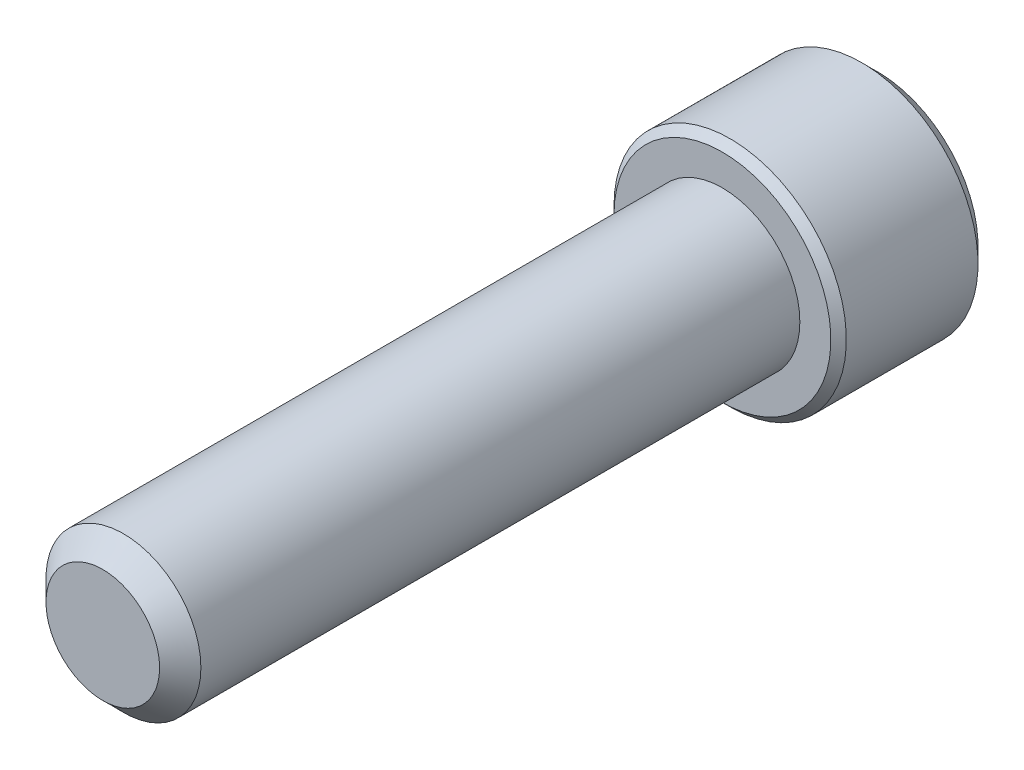
from build123d import *

# Parameters (mm, degrees)
SKETCH1_R          = 3.96875
EXTRUDE1_DEPTH     = 31.75
SKETCH6_R          = 5.953125
EXTRUDE2_DEPTH     = 7.9375
CUT_EXTRUDE1_DEPTH = 4.7625
SKETCH8_R          = 3.666174209
CUT_EXTRUDE2_DEPTH = 0.79375
CUT_EXTRUDE2_DRAFT = -45
CHAMFER1_SIZE      = 0.79375
CHAMFER2_SIZE      = 0.396875
CHAMFER3_SIZE      = 1.058333333


with BuildPart() as part:
    # Sketch1 → Extrude1 (new body)
    with BuildSketch(Plane.XY):
        Circle(SKETCH1_R)
    extrude(amount=-EXTRUDE1_DEPTH)

    # Sketch6 → Extrude2 (add)
    with BuildSketch(Plane(origin=(0, 0, -31.75), x_dir=(-1, 0, 0), z_dir=(0, 0, -1))):
        Circle(SKETCH6_R)
    extrude(amount=EXTRUDE2_DEPTH)

    # Sketch7 → Cut-Extrude1 (cut)
    with BuildSketch(Plane(origin=(0, 0, -39.6875), x_dir=(-1, 0, 0), z_dir=(0, 0, -1))):
        Polygon((0, 3.666174209), (-3.175, 1.833087105), (-3.175, -1.833087105), (0, -3.666174209), (3.175, -1.833087105), (3.175, 1.833087105), align=None)
    extrude(amount=-CUT_EXTRUDE1_DEPTH, mode=Mode.SUBTRACT)


with BuildPart() as cut_extrude2_tool:
    # Sketch8 → Cut-Extrude2 (with draft: the straight prism first)
    with BuildSketch(Plane(origin=(0, 0, -39.6875), x_dir=(-1, 0, 0), z_dir=(0, 0, -1))):
        Circle(SKETCH8_R)
    extrude(amount=-CUT_EXTRUDE2_DEPTH)
    # Cut-Extrude2: the draft: its side faces are tilted about the plane it starts from
    cut_extrude2_sides = [cut_extrude2_tool.faces().sort_by_distance(p)[0] for p in [
        (3.666174209, 0, -39.290625),
    ]]
    draft(cut_extrude2_sides, Plane(origin=(0, 0, -39.6875), x_dir=(-1, 0, 0), z_dir=(0, 0, -1)), CUT_EXTRUDE2_DRAFT)


with BuildPart() as part_1:
    add(part.part)

    # Cut-Extrude2: cut by cut_extrude2_tool
    add(cut_extrude2_tool.part, mode=Mode.SUBTRACT)

    # Chamfer1
    chamfer1_edges = [part_1.edges().sort_by_distance(p)[0] for p in [
        (5.953125, 0, -39.6875),
    ]]
    chamfer(chamfer1_edges, length=CHAMFER1_SIZE)

    # Chamfer2
    chamfer2_edges = [part_1.edges().sort_by_distance(p)[0] for p in [
        (5.953125, 0, -31.75),
    ]]
    chamfer(chamfer2_edges, length=CHAMFER2_SIZE)

    # Chamfer3
    chamfer3_edges = [part_1.edges().sort_by_distance(p)[0] for p in [
        (-3.96875, 0, 0),
    ]]
    chamfer(chamfer3_edges, length=CHAMFER3_SIZE)


solid = part_1.part
